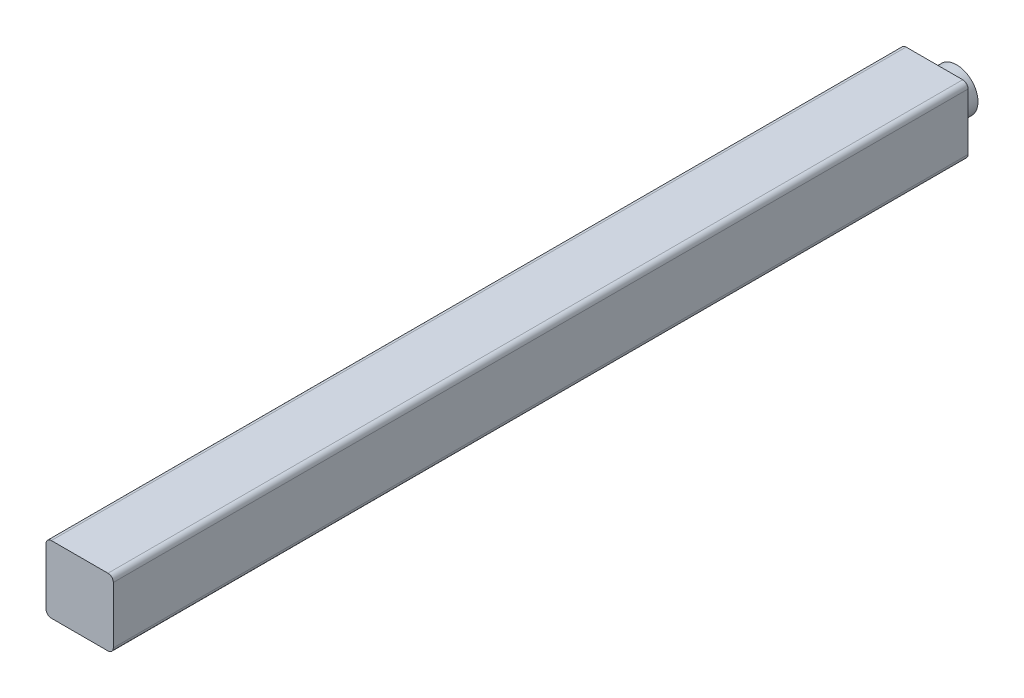
from build123d import *

# Parameters (mm, degrees)
BOSS_EXTRUDE1_DEPTH = 40
SKETCH3_R           = 1
BOSS_EXTRUDE2_DEPTH = 1


with BuildPart() as part:
    # Sketch2 → Boss-Extrude1 (new body)
    with BuildSketch(Plane.XY):
        with BuildLine():
            Line((0.25, 0), (2.9, 0))
            ThreePointArc((2.9, 0), (3.076776695, 0.073223305), (3.15, 0.25))
            Line((3.15, 0.25), (3.15, 2.9))
            ThreePointArc((3.15, 2.9), (3.076776695, 3.076776695), (2.9, 3.15))
            Line((2.9, 3.15), (0.25, 3.15))
            ThreePointArc((0.25, 3.15), (0.073223305, 3.076776695), (0, 2.9))
            Line((0, 2.9), (0, 0.25))
            ThreePointArc((0, 0.25), (0.073223305, 0.073223305), (0.25, 0))
        make_face()
    extrude(amount=BOSS_EXTRUDE1_DEPTH)

    # Sketch3 → Boss-Extrude2 (add)
    with BuildSketch(Plane(origin=(0, 0, 0), x_dir=(-1, 0, 0), z_dir=(0, 0, -1))):
        with Locations(Location((-1.615, 1.615, 0), (0, 0, 180))):
            Circle(SKETCH3_R)
    extrude(amount=BOSS_EXTRUDE2_DEPTH)


solid = part.part
